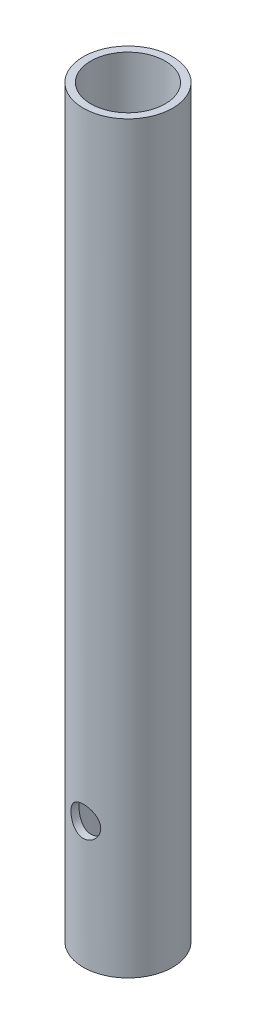
from build123d import *

# Parameters (mm, degrees)
SKETCH_1_R               = 6
SKETCH_1_R_2             = 5
EXTRUDE_1_DEPTH          = 100
CUT_EXTRUDE_1_DEPTH      = 101.359354322
CUT_EXTRUDE_1_DEPTH_BACK = 101.359354322
SKETCH_2_R               = 2


with BuildPart() as part:
    # 草图1 → 拉伸-薄壁1 (new body)
    with BuildSketch(Plane(origin=(0, 0, 0), x_dir=(1, 0, 0), z_dir=(0, 1, 0))):
        Circle(SKETCH_1_R)
        Circle(SKETCH_1_R_2, mode=Mode.SUBTRACT)
    extrude(amount=EXTRUDE_1_DEPTH)

    # 草图2 → 切除-拉伸1 (cut, two sides: drawn at the far end of the back side and taken through both)
    with BuildSketch(Plane.XY.offset(-CUT_EXTRUDE_1_DEPTH_BACK)):
        with Locations((0, 17)):
            Circle(SKETCH_2_R)
    extrude(amount=CUT_EXTRUDE_1_DEPTH + CUT_EXTRUDE_1_DEPTH_BACK, mode=Mode.SUBTRACT)


solid = part.part
